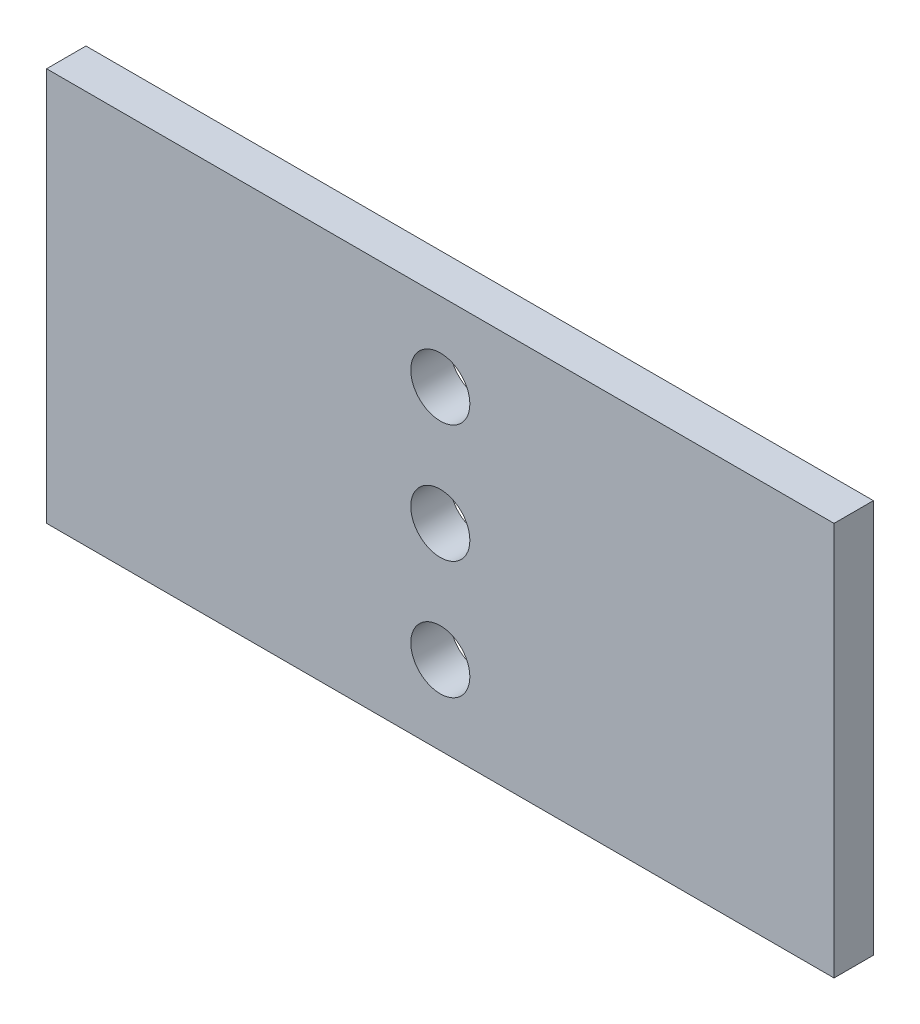
from build123d import *

# Parameters (mm, degrees)
SKETCH1_W           = 200
SKETCH1_H           = 100
SKETCH1_R           = 7.5
BOSS_EXTRUDE1_DEPTH = 10


with BuildPart() as part:
    # Sketch1 → Boss-Extrude1 (new body)
    with BuildSketch(Plane.XY):
        Rectangle(SKETCH1_W, SKETCH1_H)
        Circle(SKETCH1_R, mode=Mode.SUBTRACT)
        with Locations((0, 30)):
            Circle(SKETCH1_R, mode=Mode.SUBTRACT)
        with Locations((0, -30)):
            Circle(SKETCH1_R, mode=Mode.SUBTRACT)
    extrude(amount=BOSS_EXTRUDE1_DEPTH)


solid = part.part
